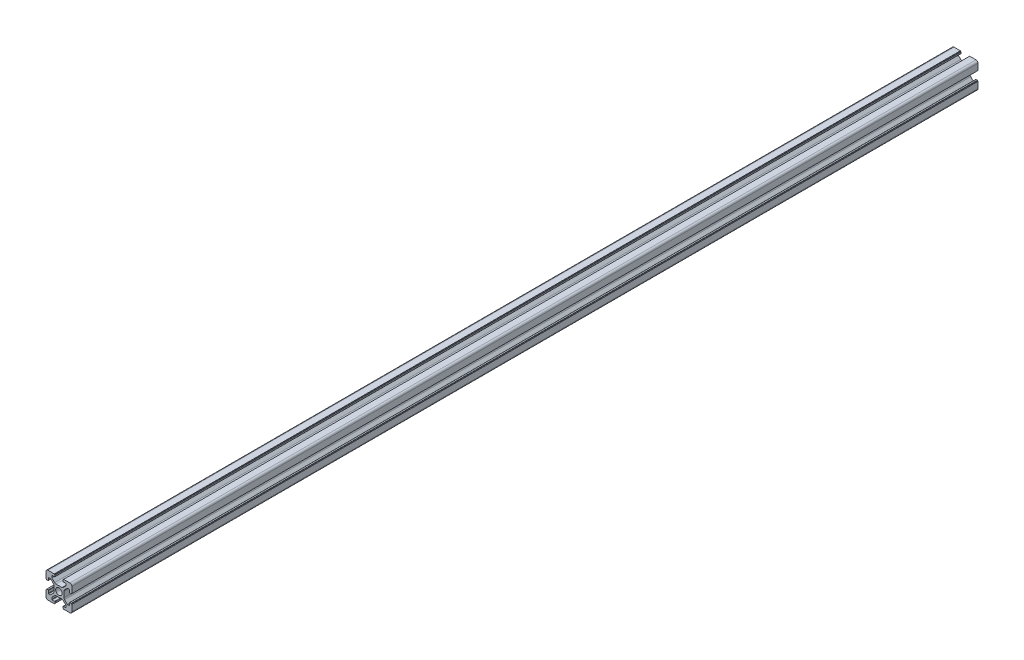
from build123d import *

# Parameters (mm, degrees)
SKETCH_1_R      = 2.5
EXTRUDE_1_DEPTH = 700


with BuildPart() as part:
    # 草图1 → 凸台-拉伸1 (new body)
    with BuildSketch(Plane.XY):
        with BuildLine():
            Line((4.215995631, 3.244230202), (6.436655803, 5.464890373))
            Line((6.436655803, 5.464890373), (7.776655803, 5.464890373))
            ThreePointArc((7.776655803, 5.464890373), (7.988787838, 5.377022408), (8.076655803, 5.164890373))
            Line((8.076655803, 5.164890373), (8.076655803, 3.364890373))
            ThreePointArc((8.076655803, 3.364890373), (8.164523769, 3.152758339), (8.376655803, 3.064890373))
            Line((8.376655803, 3.064890373), (9.376655803, 3.064890373))
            Line((9.376655803, 3.064890373), (9.376655803, 3.364890373))
            ThreePointArc((9.376655803, 3.364890373), (9.435234447, 3.50631173), (9.576655803, 3.564890373))
            Line((9.576655803, 3.564890373), (9.876655803, 3.564890373))
            Line((9.876655803, 3.564890373), (9.876655803, 8.464890373))
            ThreePointArc((9.876655803, 8.464890373), (9.437315975, 9.525550545), (8.376655803, 9.964890373))
            Line((8.376655803, 9.964890373), (3.476655803, 9.964890373))
            Line((3.476655803, 9.964890373), (3.476655803, 9.664890373))
            ThreePointArc((3.476655803, 9.664890373), (3.418077159, 9.523469017), (3.276655803, 9.464890373))
            Line((3.276655803, 9.464890373), (2.976655803, 9.464890373))
            Line((2.976655803, 9.464890373), (2.976655803, 8.464890373))
            ThreePointArc((2.976655803, 8.464890373), (3.064523769, 8.252758339), (3.276655803, 8.164890373))
            Line((3.276655803, 8.164890373), (5.076655803, 8.164890373))
            ThreePointArc((5.076655803, 8.164890373), (5.288787838, 8.077022408), (5.376655803, 7.864890373))
            Line((5.376655803, 7.864890373), (5.376655803, 6.524890373))
            Line((5.376655803, 6.524890373), (3.155995631, 4.304230202))
            ThreePointArc((3.155995631, 4.304230202), (2.669360608, 3.979071075), (2.09533546, 3.864890373))
            Line((2.09533546, 3.864890373), (-2.342023853, 3.864890373))
            ThreePointArc((-2.342023853, 3.864890373), (-2.916049002, 3.979071075), (-3.402684025, 4.304230202))
            Line((-3.402684025, 4.304230202), (-5.623344197, 6.524890373))
            Line((-5.623344197, 6.524890373), (-5.623344197, 7.864890373))
            ThreePointArc((-5.623344197, 7.864890373), (-5.535476231, 8.077022408), (-5.323344197, 8.164890373))
            Line((-5.323344197, 8.164890373), (-3.523344197, 8.164890373))
            ThreePointArc((-3.523344197, 8.164890373), (-3.311212162, 8.252758339), (-3.223344197, 8.464890373))
            Line((-3.223344197, 8.464890373), (-3.223344197, 9.464890373))
            Line((-3.223344197, 9.464890373), (-3.523344197, 9.464890373))
            ThreePointArc((-3.523344197, 9.464890373), (-3.664765553, 9.523469017), (-3.723344197, 9.664890373))
            Line((-3.723344197, 9.664890373), (-3.723344197, 9.964890373))
            Line((-3.723344197, 9.964890373), (-8.623344197, 9.964890373))
            ThreePointArc((-8.623344197, 9.964890373), (-9.684004369, 9.525550545), (-10.123344197, 8.464890373))
            Line((-10.123344197, 8.464890373), (-10.123344197, 3.564890373))
            Line((-10.123344197, 3.564890373), (-9.823344197, 3.564890373))
            ThreePointArc((-9.823344197, 3.564890373), (-9.681922841, 3.50631173), (-9.623344197, 3.364890373))
            Line((-9.623344197, 3.364890373), (-9.623344197, 3.064890373))
            Line((-9.623344197, 3.064890373), (-8.623344197, 3.064890373))
            ThreePointArc((-8.623344197, 3.064890373), (-8.411212162, 3.152758339), (-8.323344197, 3.364890373))
            Line((-8.323344197, 3.364890373), (-8.323344197, 5.164890373))
            ThreePointArc((-8.323344197, 5.164890373), (-8.235476231, 5.377022408), (-8.023344197, 5.464890373))
            Line((-8.023344197, 5.464890373), (-6.683344197, 5.464890373))
            Line((-6.683344197, 5.464890373), (-4.462684025, 3.244230202))
            ThreePointArc((-4.462684025, 3.244230202), (-4.137524898, 2.757595178), (-4.023344197, 2.18357003))
            Line((-4.023344197, 2.18357003), (-4.023344197, -2.253789283))
            ThreePointArc((-4.023344197, -2.253789283), (-4.137524898, -2.827814432), (-4.462684025, -3.314449455))
            Line((-4.462684025, -3.314449455), (-6.683344197, -5.535109627))
            Line((-6.683344197, -5.535109627), (-8.023344197, -5.535109627))
            ThreePointArc((-8.023344197, -5.535109627), (-8.235476231, -5.447241661), (-8.323344197, -5.235109627))
            Line((-8.323344197, -5.235109627), (-8.323344197, -3.435109627))
            ThreePointArc((-8.323344197, -3.435109627), (-8.411212162, -3.222977592), (-8.623344197, -3.135109627))
            Line((-8.623344197, -3.135109627), (-9.623344197, -3.135109627))
            Line((-9.623344197, -3.135109627), (-9.623344197, -3.435109627))
            ThreePointArc((-9.623344197, -3.435109627), (-9.681922841, -3.576530983), (-9.823344197, -3.635109627))
            Line((-9.823344197, -3.635109627), (-10.123344197, -3.635109627))
            Line((-10.123344197, -3.635109627), (-10.123344197, -8.535109627))
            ThreePointArc((-10.123344197, -8.535109627), (-9.684004369, -9.595769798), (-8.623344197, -10.035109627))
            Line((-8.623344197, -10.035109627), (-3.723344197, -10.035109627))
            Line((-3.723344197, -10.035109627), (-3.723344197, -9.735109627))
            ThreePointArc((-3.723344197, -9.735109627), (-3.664765553, -9.59368827), (-3.523344197, -9.535109627))
            Line((-3.523344197, -9.535109627), (-3.223344197, -9.535109627))
            Line((-3.223344197, -9.535109627), (-3.223344197, -8.535109627))
            ThreePointArc((-3.223344197, -8.535109627), (-3.311212162, -8.322977592), (-3.523344197, -8.235109627))
            Line((-3.523344197, -8.235109627), (-5.323344197, -8.235109627))
            ThreePointArc((-5.323344197, -8.235109627), (-5.535476231, -8.147241661), (-5.623344197, -7.935109627))
            Line((-5.623344197, -7.935109627), (-5.623344197, -6.595109627))
            Line((-5.623344197, -6.595109627), (-3.402684025, -4.374449455))
            ThreePointArc((-3.402684025, -4.374449455), (-2.916049002, -4.049290328), (-2.342023853, -3.935109627))
            Line((-2.342023853, -3.935109627), (2.09533546, -3.935109627))
            ThreePointArc((2.09533546, -3.935109627), (2.669360608, -4.049290328), (3.155995631, -4.374449455))
            Line((3.155995631, -4.374449455), (5.376655803, -6.595109627))
            Line((5.376655803, -6.595109627), (5.376655803, -7.935109627))
            ThreePointArc((5.376655803, -7.935109627), (5.288787838, -8.147241661), (5.076655803, -8.235109627))
            Line((5.076655803, -8.235109627), (3.276655803, -8.235109627))
            ThreePointArc((3.276655803, -8.235109627), (3.064523769, -8.322977592), (2.976655803, -8.535109627))
            Line((2.976655803, -8.535109627), (2.976655803, -9.535109627))
            Line((2.976655803, -9.535109627), (3.276655803, -9.535109627))
            ThreePointArc((3.276655803, -9.535109627), (3.418077159, -9.59368827), (3.476655803, -9.735109627))
            Line((3.476655803, -9.735109627), (3.476655803, -10.035109627))
            Line((3.476655803, -10.035109627), (8.376655803, -10.035109627))
            ThreePointArc((8.376655803, -10.035109627), (9.437315975, -9.595769798), (9.876655803, -8.535109627))
            Line((9.876655803, -8.535109627), (9.876655803, -3.635109627))
            Line((9.876655803, -3.635109627), (9.576655803, -3.635109627))
            ThreePointArc((9.576655803, -3.635109627), (9.435234447, -3.576530983), (9.376655803, -3.435109627))
            Line((9.376655803, -3.435109627), (9.376655803, -3.135109627))
            Line((9.376655803, -3.135109627), (8.376655803, -3.135109627))
            ThreePointArc((8.376655803, -3.135109627), (8.164523769, -3.222977592), (8.076655803, -3.435109627))
            Line((8.076655803, -3.435109627), (8.076655803, -5.235109627))
            ThreePointArc((8.076655803, -5.235109627), (7.988787838, -5.447241661), (7.776655803, -5.535109627))
            Line((7.776655803, -5.535109627), (6.436655803, -5.535109627))
            Line((6.436655803, -5.535109627), (4.215995631, -3.314449455))
            ThreePointArc((4.215995631, -3.314449455), (3.890836504, -2.827814432), (3.776655803, -2.253789283))
            Line((3.776655803, -2.253789283), (3.776655803, 2.18357003))
            ThreePointArc((3.776655803, 2.18357003), (3.890836504, 2.757595178), (4.215995631, 3.244230202))
        make_face()
        with Locations((-0.123344197, -0.035109627)):
            Circle(SKETCH_1_R, mode=Mode.SUBTRACT)
    extrude(amount=EXTRUDE_1_DEPTH)


solid = part.part
